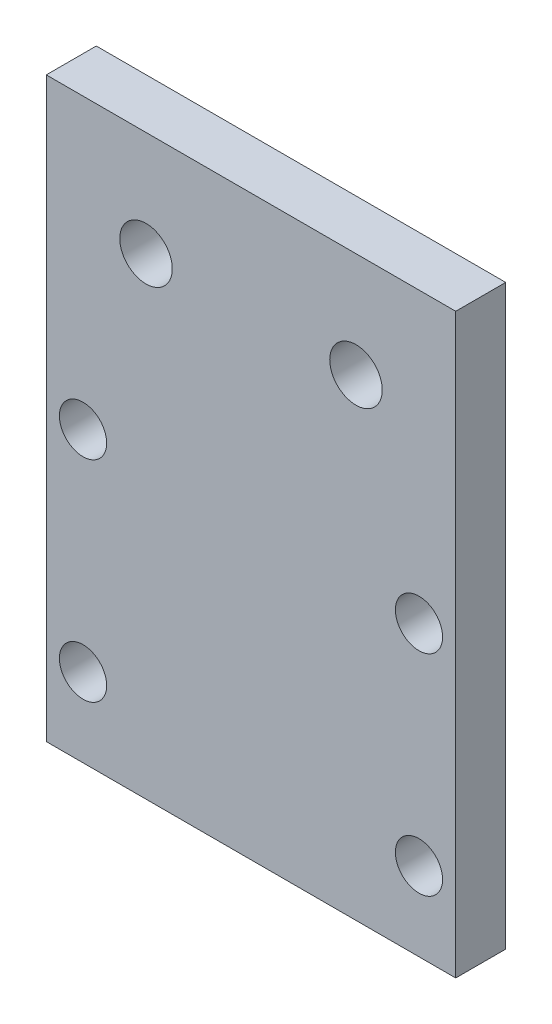
from build123d import *

# Parameters (mm, degrees)
SKETCH1_W           = 39
SKETCH1_H           = 55
SKETCH1_R           = 2.5
SKETCH1_R_2         = 2.25
BOSS_EXTRUDE1_DEPTH = 4.7625


with BuildPart() as part:
    # Sketch1 → Boss-Extrude1 (new body)
    with BuildSketch(Plane.XY):
        with Locations((16, 20)):
            Rectangle(SKETCH1_W, SKETCH1_H)
        with Locations((6, 37.5)):
            Circle(SKETCH1_R, mode=Mode.SUBTRACT)
        with Locations((26, 37.5)):
            Circle(SKETCH1_R, mode=Mode.SUBTRACT)
        Circle(SKETCH1_R_2, mode=Mode.SUBTRACT)
        with Locations((0, 20)):
            Circle(SKETCH1_R_2, mode=Mode.SUBTRACT)
        with Locations((32, 0)):
            Circle(SKETCH1_R_2, mode=Mode.SUBTRACT)
        with Locations((32, 20)):
            Circle(SKETCH1_R_2, mode=Mode.SUBTRACT)
    extrude(amount=BOSS_EXTRUDE1_DEPTH)


solid = part.part
